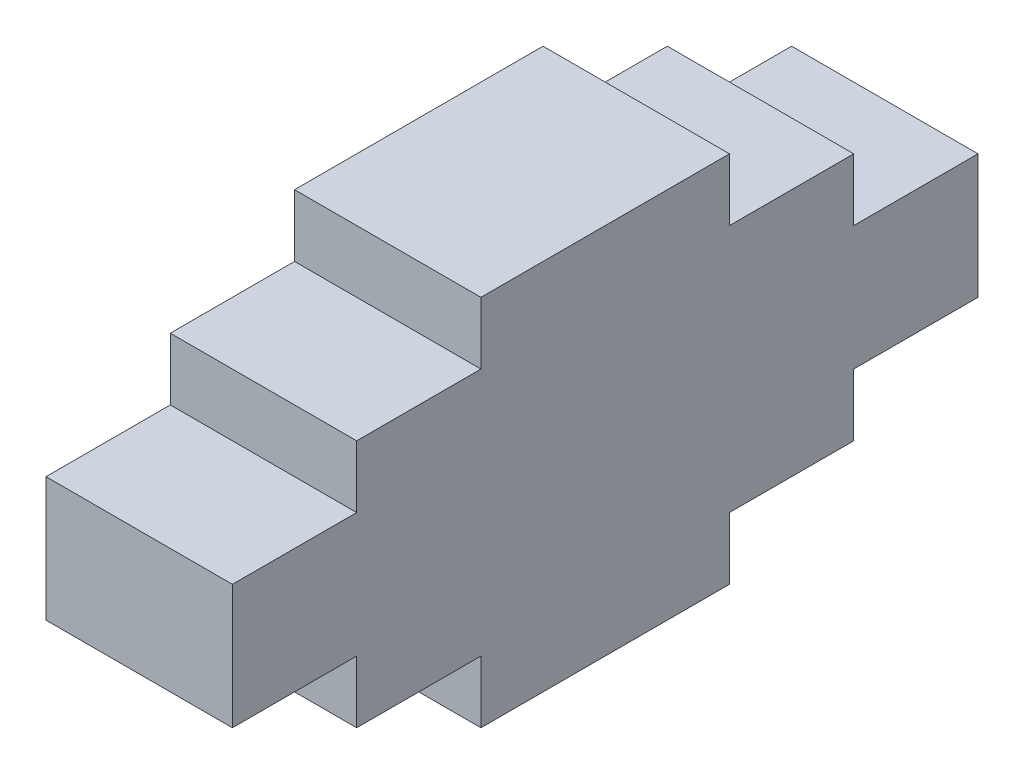
from build123d import *

# Parameters (mm, degrees)
BOSS_EXTRUDE1_DEPTH = 30


with BuildPart() as part:
    # Sketch1 → Boss-Extrude1 (new body)
    with BuildSketch(Plane(origin=(0, 0, 0), x_dir=(0, 0, -1), z_dir=(1, 0, 0))):
        Polygon((-60, -10), (-60, 10), (-40, 10), (-40, 20), (-20, 20), (-20, 30), (20, 30), (20, 20), (40, 20), (40, 10), (60, 10), (60, -10), (40, -10), (40, -20), (20, -20), (20, -30), (-20, -30), (-20, -20), (-40, -20), (-40, -10), align=None)
    extrude(amount=BOSS_EXTRUDE1_DEPTH)


solid = part.part
